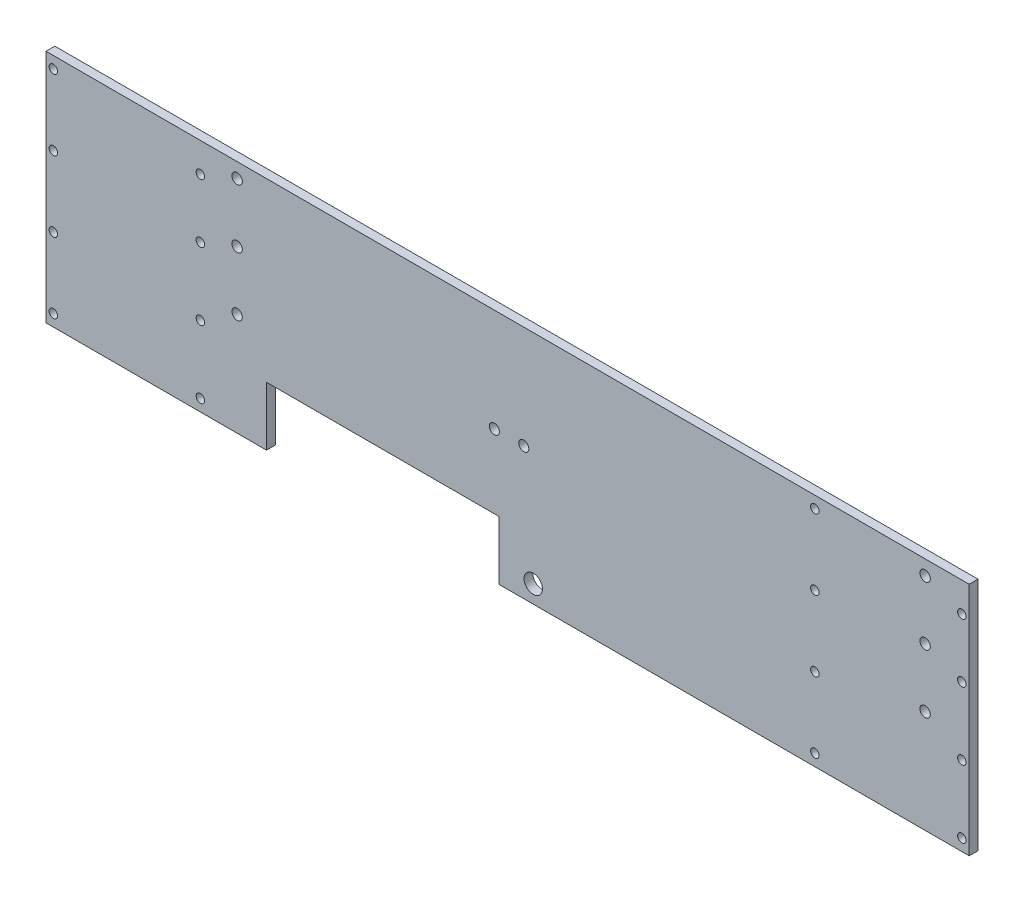
from build123d import *

# Parameters (mm, degrees)
SKETCH1_W                            = 398.78
SKETCH1_H                            = 101.6
BOSS_EXTRUDE1_DEPTH                  = 3.81
SKETCH11_W                           = 100.33
SKETCH11_H                           = 25.4
CUT_EXTRUDE1_DEPTH                   = 206.794869227
F_5_16_0_3125_DIAMETER_HOLE1_D       = 7.9375
F_6_CLEARANCE_HOLE1_D                = 3.6576
F_8_CLEARANCE_HOLE1_D                = 4.4958
LPATTERN1_COUNT                      = 2
LPATTERN1_PITCH                      = 328.93
F_11_64_0_17188_DIAMETER_HOLE2_D     = 4.365752
F_11_64_0_17188_DIAMETER_HOLE2_DEPTH = 8.89
F_11_64_0_17188_DIAMETER_HOLE2_TIP   = 1.311604225


with BuildPart() as part:
    # Sketch1 → Boss-Extrude1 (new body)
    with BuildSketch(Plane.XY):
        Rectangle(SKETCH1_W, SKETCH1_H)
    extrude(amount=BOSS_EXTRUDE1_DEPTH)

    # Sketch11 → Cut-Extrude1 (cut, through all)
    with BuildSketch(Plane.XY.offset(3.81)):
        with Locations((-53.975, -38.1)):
            Rectangle(SKETCH11_W, SKETCH11_H)
    extrude(amount=-CUT_EXTRUDE1_DEPTH, mode=Mode.SUBTRACT)

    # 5/16 (0.3125) Diameter Hole1 (through all)
    with Locations(Plane.XY.offset(3.81)):
        with Locations((11.074908, -43.18)):
            Hole(F_5_16_0_3125_DIAMETER_HOLE1_D / 2)

    # #6 Clearance Hole1 (through all)
    with Locations(Plane.XY.offset(3.81)):
        with Locations((132.715, -15.24), (196.215, -16.51), (196.215, 12.7), (196.215, 38.1), (132.715, 45.72), (132.715, 15.24), (132.715, -45.72), (196.215, -45.72)):
            f_6_clearance_hole1 = Hole(F_6_CLEARANCE_HOLE1_D / 2)

    # #8 Clearance Hole1 (through all)
    with Locations(Plane.XY.offset(3.81)):
        with Locations((180.34, 44.45), (180.34, 19.05), (180.34, -6.35), (-116.84, 44.45), (-116.84, 19.05), (-116.84, -6.35)):
            Hole(F_8_CLEARANCE_HOLE1_D / 2)

    # LPattern1: #6 Clearance Hole1 ×2
    with Locations(*[(-i * LPATTERN1_PITCH, 0, 0) for i in range(1, LPATTERN1_COUNT)]):
        add(f_6_clearance_hole1, mode=Mode.SUBTRACT)

    # 11/64 (0.17188) Diameter Hole2
    with Locations(Plane.XY.offset(3.81)):
        with Locations((-5.715, 6.35), (6.985, 6.35)):
            Hole(F_11_64_0_17188_DIAMETER_HOLE2_D / 2, depth=F_11_64_0_17188_DIAMETER_HOLE2_DEPTH)
            with Locations((0, 0, -(F_11_64_0_17188_DIAMETER_HOLE2_DEPTH + F_11_64_0_17188_DIAMETER_HOLE2_TIP / 2))):  # 118° drill point
                Cone(0, F_11_64_0_17188_DIAMETER_HOLE2_D / 2, F_11_64_0_17188_DIAMETER_HOLE2_TIP, mode=Mode.SUBTRACT)


solid = part.part
